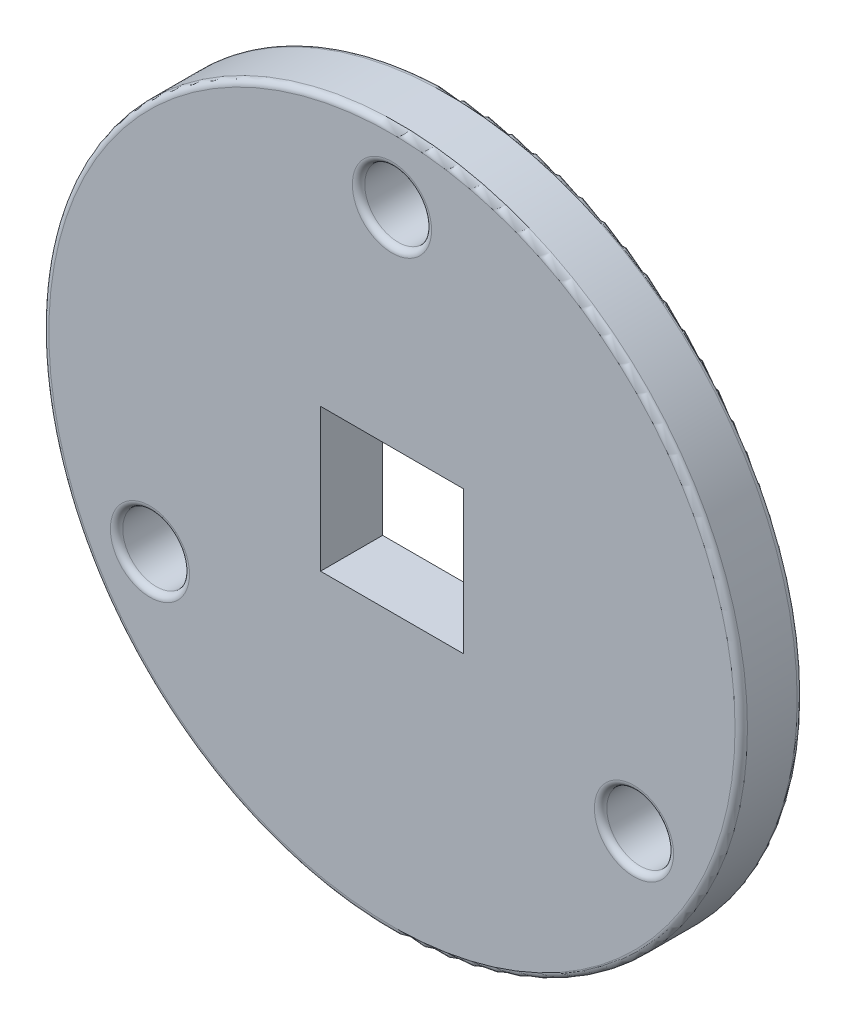
from build123d import *

# Parameters (mm, degrees)
SKETCH1_R           = 112.5
SKETCH1_R_2         = 10.75
SKETCH1_W           = 46
SKETCH1_H           = 46
BOSS_EXTRUDE1_DEPTH = 20
FILLET9_R           = 2


with BuildPart() as part:
    # Sketch1 → Boss-Extrude1 (new body)
    with BuildSketch(Plane.XY):
        Circle(SKETCH1_R)
        with Locations((0, 90)):
            Circle(SKETCH1_R_2, mode=Mode.SUBTRACT)
        with Locations((77.942286341, -45)):
            Circle(SKETCH1_R_2, mode=Mode.SUBTRACT)
        with Locations((-77.942286341, -45)):
            Circle(SKETCH1_R_2, mode=Mode.SUBTRACT)
        Rectangle(SKETCH1_W, SKETCH1_H, mode=Mode.SUBTRACT)
    extrude(amount=BOSS_EXTRUDE1_DEPTH)

    # Fillet9
    fillet9_edges = [part.edges().sort_by_distance(p)[0] for p in [
        (-10.75, 90, 0),
        (-10.75, 90, 20),
        (-112.5, 0, 0),
        (67.192286341, -45, 0),
        (67.192286341, -45, 20),
        (-88.692286341, -45, 0),
        (-88.692286341, -45, 20),
        (-112.5, 0, 20),
    ]]
    fillet(fillet9_edges, radius=FILLET9_R)


solid = part.part
